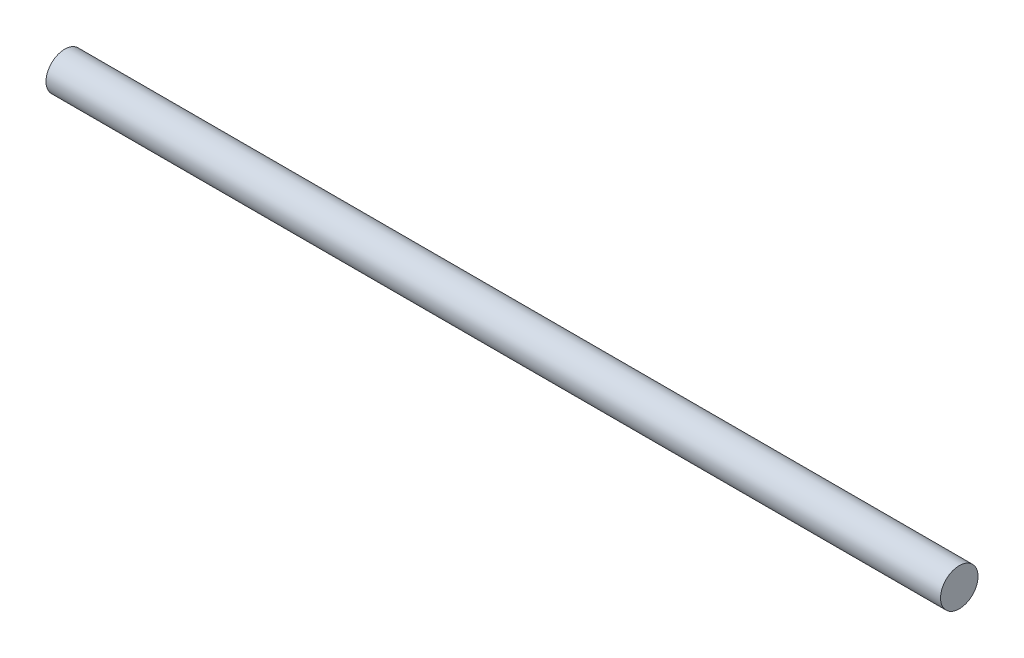
from build123d import *

# Parameters (mm, degrees)
SKETCH1_R           = 8.89
BOSS_EXTRUDE1_DEPTH = 424.18


with BuildPart() as part:
    # Sketch1 → Boss-Extrude1 (new body)
    with BuildSketch(Plane.YZ):
        with Locations(Location((0, 0, 0), (0, 0, 90))):
            Circle(SKETCH1_R)
    extrude(amount=BOSS_EXTRUDE1_DEPTH)


solid = part.part
